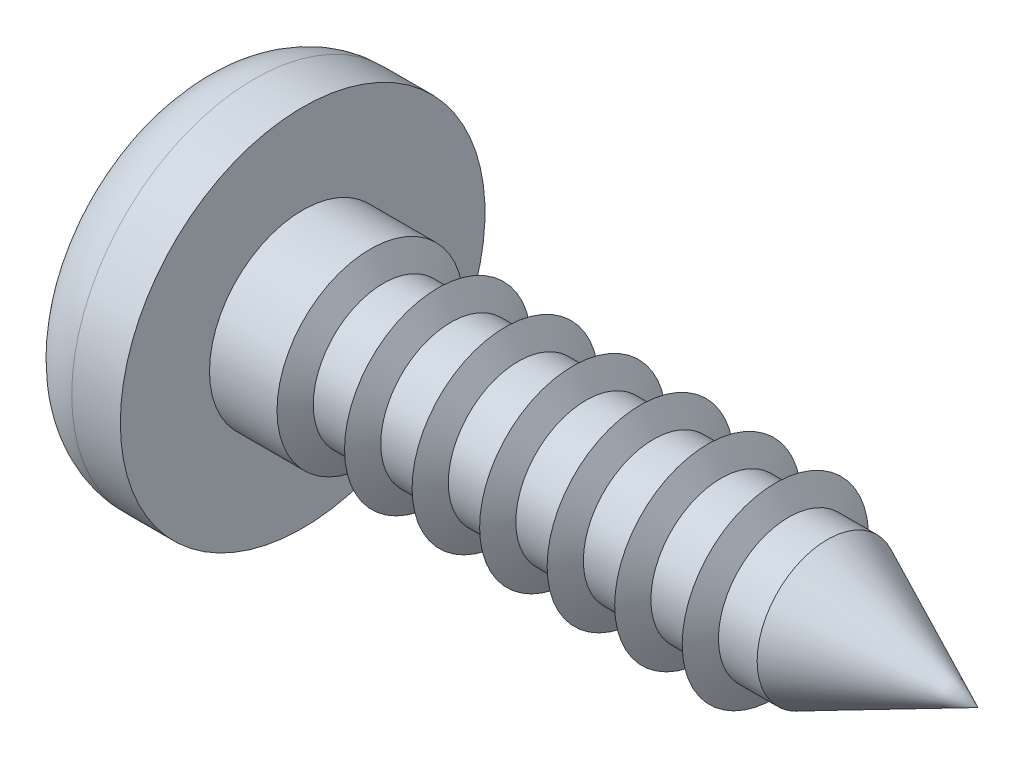
from build123d import *

# Parameters (mm, degrees)
RECESSII_CUT_EXTRUDE11_DEPTH = 2.0574
DRAFT2_ANGLE                 = 20
LPATTERN1_COUNT              = 9
LPATTERN1_PITCH              = 1.27


with BuildPart() as part:
    # Sketch1 → base-Revolve (revolve)
    with BuildSketch(Plane.XY, mode=Mode.PRIVATE) as base_revolve_sk:
        with BuildLine():
            Line((0, 0), (0, 2.2606))
            ThreePointArc((0, 2.2606), (0.342216437, 3.086783563), (1.1684, 3.429))
            Line((1.1684, 3.429), (2.0828, 3.429))
            Line((2.0828, 3.429), (2.0828, 1.7526))
            Line((2.0828, 1.7526), (14.7828, 1.7526))
            Line((14.7828, 1.7526), (14.7828, 0))
            Line((14.7828, 0), (0, 0))
        make_face()
    revolve(base_revolve_sk.sketch.rotate(Axis((0, 0, 0), (1, 0, 0)), 90), axis=Axis((0, 0, 0), (1, 0, 0)))

    # Sketch3 → recessII_Cut-Extrude11 (cut)
    with BuildSketch(Plane(origin=(0, 0, 0), x_dir=(0, 0, -1), z_dir=(1, 0, 0))):
        Polygon((0.4699, 2.1463), (-0.4699, 2.1463), (-0.4699, 0.4699), (-2.1463, 0.4699), (-2.1463, -0.4699), (-0.4699, -0.4699), (-0.4699, -2.1463), (0.4699, -2.1463), (0.4699, -0.4699), (2.1463, -0.4699), (2.1463, 0.4699), (0.4699, 0.4699), align=None)
    extrude(amount=RECESSII_CUT_EXTRUDE11_DEPTH, mode=Mode.SUBTRACT)

    # Draft2
    draft2_faces = [part.faces().sort_by_distance(p)[0] for p in [
        (1.0287, 0, -2.1463),
        (1.0287, -2.1463, 0),
        (1.0287, 0, 2.1463),
        (1.0287, 2.1463, 0),
    ]]
    draft(draft2_faces, Plane(origin=(0, 0, 0), x_dir=(0, 0, -1), z_dir=(-1, 0, 0)), DRAFT2_ANGLE)

    # thd_Sketch7 → thd_Cut-Revolve2 (revolve, cut)
    with BuildSketch(Plane.XY, mode=Mode.PRIVATE) as thd_cut_revolve2_sk:
        Polygon((3.3528, 1.7526), (3.602099846, 1.3208), (4.373500154, 1.3208), (4.6228, 1.7526), align=None)
    thd_cut_revolve2 = revolve(thd_cut_revolve2_sk.sketch.rotate(Axis((0, 0, 0), (1, 0, 0)), 90), axis=Axis((0, 0, 0), (1, 0, 0)), mode=Mode.SUBTRACT)

    # LPattern1: thd_Cut-Revolve2 ×9
    with Locations(*[(i * LPATTERN1_PITCH, 0, 0) for i in range(1, LPATTERN1_COUNT)]):
        add(thd_cut_revolve2, mode=Mode.SUBTRACT)

    # Sketch14 → point_Cut-Revolve3 (revolve, cut)
    with BuildSketch(Plane.XY, mode=Mode.PRIVATE) as point_cut_revolve3_sk:
        Polygon((14.7828, 0), (11.024337171, 1.7526), (14.967254292, 1.7526), (14.967254292, 0), align=None)
    revolve(point_cut_revolve3_sk.sketch.rotate(Axis((0, 0, 0), (1, 0, 0)), 90), axis=Axis((0, 0, 0), (1, 0, 0)), mode=Mode.SUBTRACT)


solid = part.part
